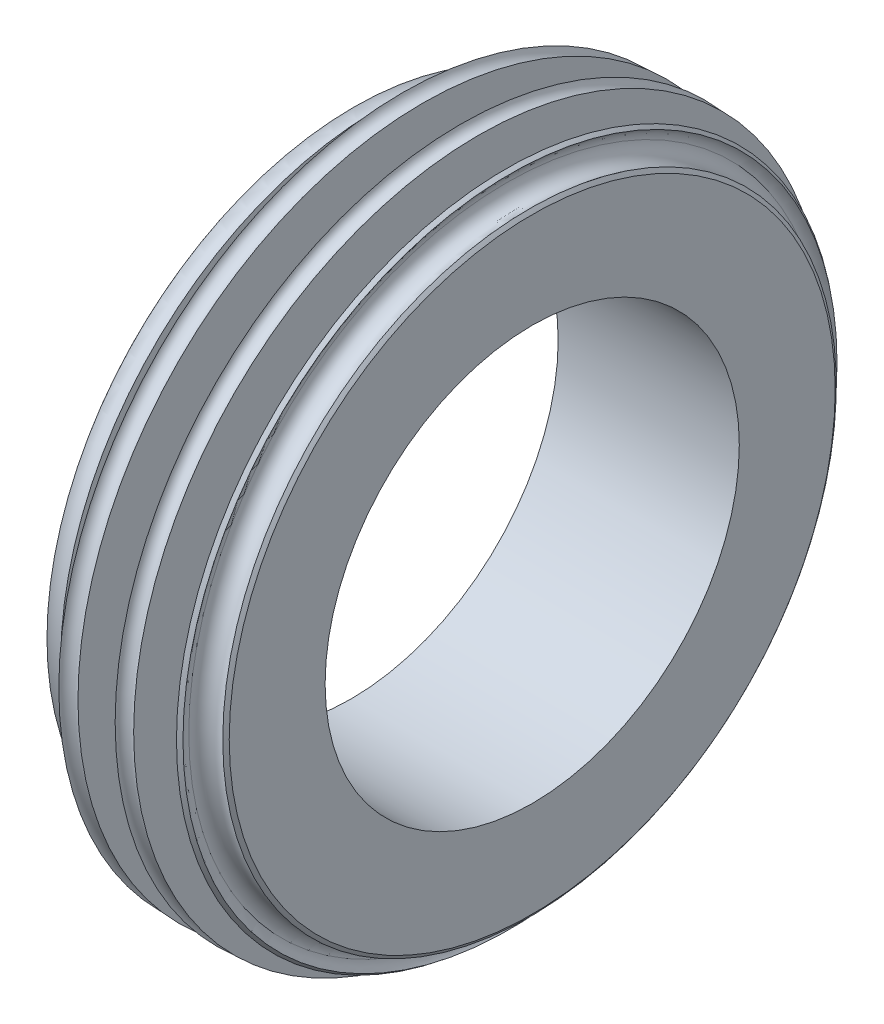
from build123d import *

# Parameters (mm, degrees)
SKETCH2_W   = 5.490494516
SKETCH2_H   = 19.152724187
SKETCH2_W_2 = 3.372668123
SKETCH2_H_2 = 15.544453676
SKETCH2_W_3 = 4.058979938
SKETCH4_R   = 1.514703905
SKETCH4_R_2 = 1.332007645
SKETCH4_R_3 = 2.045383287
SKETCH4_R_4 = 2.241314695


with BuildPart() as part:
    # Sketch1 → Revolve1 (revolve)
    with BuildSketch(Plane.XY, mode=Mode.PRIVATE) as revolve1_sk:
        with BuildLine():
            Line((-13.134008543, 30.034387182), (13.134008543, 30.034387182))
            Line((13.134008543, 30.034387182), (13.134008543, 43.940984463))
            ThreePointArc((13.134008543, 43.940984463), (0, 50.904866559), (-13.134008543, 43.940984463))
            Line((-13.134008543, 43.940984463), (-13.134008543, 30.034387182))
        make_face()
    revolve(revolve1_sk.sketch.rotate(Axis((-37.277406599, 0, 0), (1, 0, 0)), 90), axis=Axis((-37.277406599, 0, 0), (1, 0, 0)))

    # Sketch2 → Cut-Revolve1 (revolve, cut)
    with BuildSketch(Plane.XY, mode=Mode.PRIVATE) as cut_revolve1_sk:
        with Locations((0, 50.90486656)):
            Rectangle(SKETCH2_W, SKETCH2_H)
        with Locations((-7.348406532, 49.100731304)):
            Rectangle(SKETCH2_W_2, SKETCH2_H_2)
        with Locations((7.348406531, 49.100731304)):
            Rectangle(SKETCH2_W_3, SKETCH2_H_2)
    revolve(cut_revolve1_sk.sketch.rotate(Axis((30.026141884, 0, 0), (-1, 0, 0)), 270), axis=Axis((30.026141884, 0, 0), (-1, 0, 0)), mode=Mode.SUBTRACT)

    # Sketch4 → Cut-Revolve2 (revolve, cut)
    with BuildSketch(Plane.XY, mode=Mode.PRIVATE) as cut_revolve2_sk:
        with Locations((-4.222900664, 50.332613763)):
            Circle(SKETCH4_R)
        with Locations((4.046339052, 50.380267977)):
            Circle(SKETCH4_R_2)
        with Locations((11.423279787, 46.050339051)):
            Circle(SKETCH4_R_3)
        with Locations((-11.276055288, 46.201034514)):
            Circle(SKETCH4_R_4)
    revolve(cut_revolve2_sk.sketch.rotate(Axis((-21.187819447, 0, 0), (1, 0, 0)), 90), axis=Axis((-21.187819447, 0, 0), (1, 0, 0)), mode=Mode.SUBTRACT)


with BuildPart() as cut_revolve2_piece_1:
    # of the separate pieces the step leaves, piece 1, a body of its own (cut_revolve2_pieces_kept)
    add(part.part.solids().sort_by_distance((13.134008543, 0, 43.940984463))[0])


with BuildPart() as cut_revolve2_piece_2:
    # of the separate pieces the step leaves, piece 2, a body of its own (cut_revolve2_pieces_kept)
    add(part.part.solids().sort_by_distance((9.911711901, 0, 47.428292358))[0])


solid = Compound([cut_revolve2_piece_1.part, cut_revolve2_piece_2.part])
